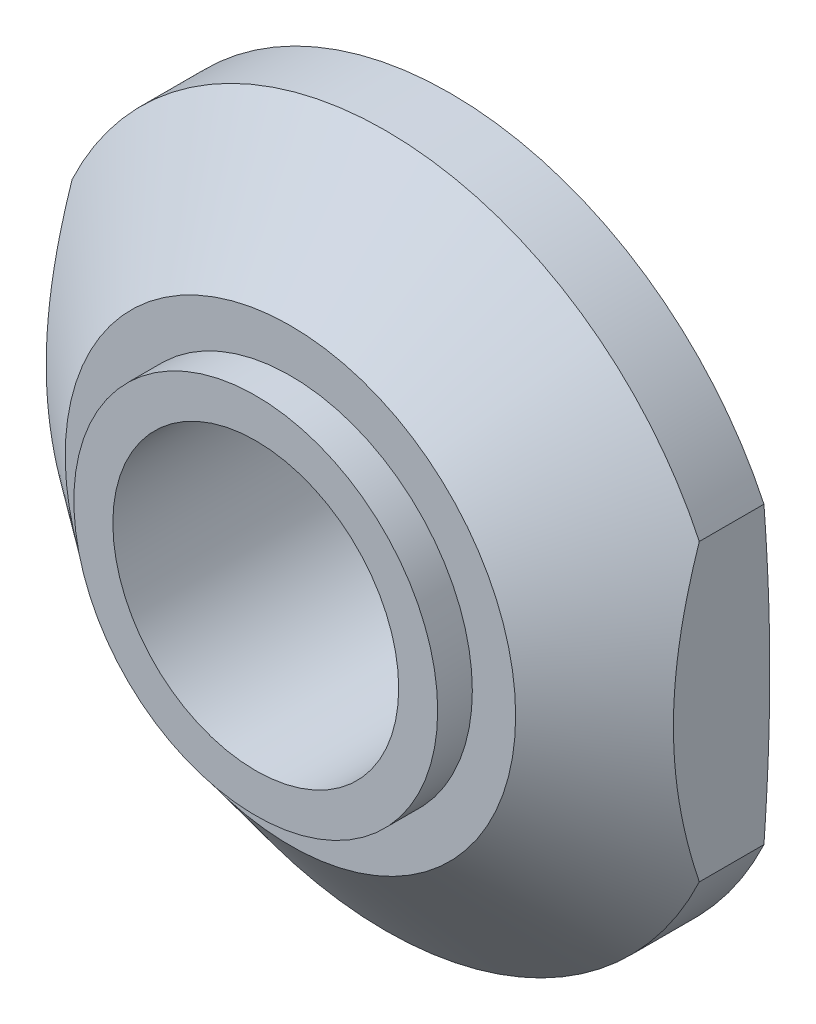
from build123d import *

# Parameters (mm, degrees)
CUT_EXTRUDE1_REACH = 17.402
SKETCH2_W          = 3.052308152
SKETCH2_H          = 16.366405324


with BuildPart() as part:
    # Sketch1 → Revolve1 (revolve)
    with BuildSketch(Plane(origin=(0, 0, 0), x_dir=(0, 0, -1), z_dir=(1, 0, 0)), mode=Mode.PRIVATE) as revolve1_sk:
        Polygon((0, 4.125), (0, 5.25), (1, 5.25), (1, 6.5), (3.75, 10), (5.615100803, 10), (6.1, 7.25), (6.1, 5.175), (7, 5.175), (7, 4.125), align=None)
    revolve(revolve1_sk.sketch.rotate(Axis((0, 0, 0), (0, 0, -1)), 90), axis=Axis((0, 0, 0), (0, 0, -1)))

    # Cut-Extrude1: up to this cone (the profile starts inside it)
    cut_extrude1_end = Plane(origin=(0, 0, -6.1), z_dir=(0, 0, -1)).offset(-10.207141857) * Cone(1.273e-06, 52.309157025, 41.100050948, align=(Align.CENTER, Align.CENTER, Align.MIN), mode=Mode.PRIVATE)
    # Sketch2 → Cut-Extrude1 (cut, up to the surface)
    with BuildSketch(Plane(origin=(0, 0, -6.1), x_dir=(-1, 0, 0), z_dir=(0, 0, -1)), mode=Mode.PRIVATE) as cut_extrude1_sk1:
        with Locations((10.576154076, 0)):
            Rectangle(SKETCH2_W, SKETCH2_H)
    cut_extrude1_tool1 = extrude(cut_extrude1_sk1.sketch, amount=-CUT_EXTRUDE1_REACH, mode=Mode.PRIVATE) & cut_extrude1_end
    add(cut_extrude1_tool1.solids().sort_by_distance((-10.576154, 0, -6.1))[0], mode=Mode.SUBTRACT)
    # Sketch2 → Cut-Extrude1 (cut, up to the surface)
    with BuildSketch(Plane(origin=(0, 0, -6.1), x_dir=(-1, 0, 0), z_dir=(0, 0, -1)), mode=Mode.PRIVATE) as cut_extrude1_sk2:
        with Locations((-10.576154076, 0)):
            Rectangle(SKETCH2_W, SKETCH2_H)
    cut_extrude1_tool2 = extrude(cut_extrude1_sk2.sketch, amount=-CUT_EXTRUDE1_REACH, mode=Mode.PRIVATE) & cut_extrude1_end
    add(cut_extrude1_tool2.solids().sort_by_distance((10.576154, 0, -6.1))[0], mode=Mode.SUBTRACT)


solid = part.part
